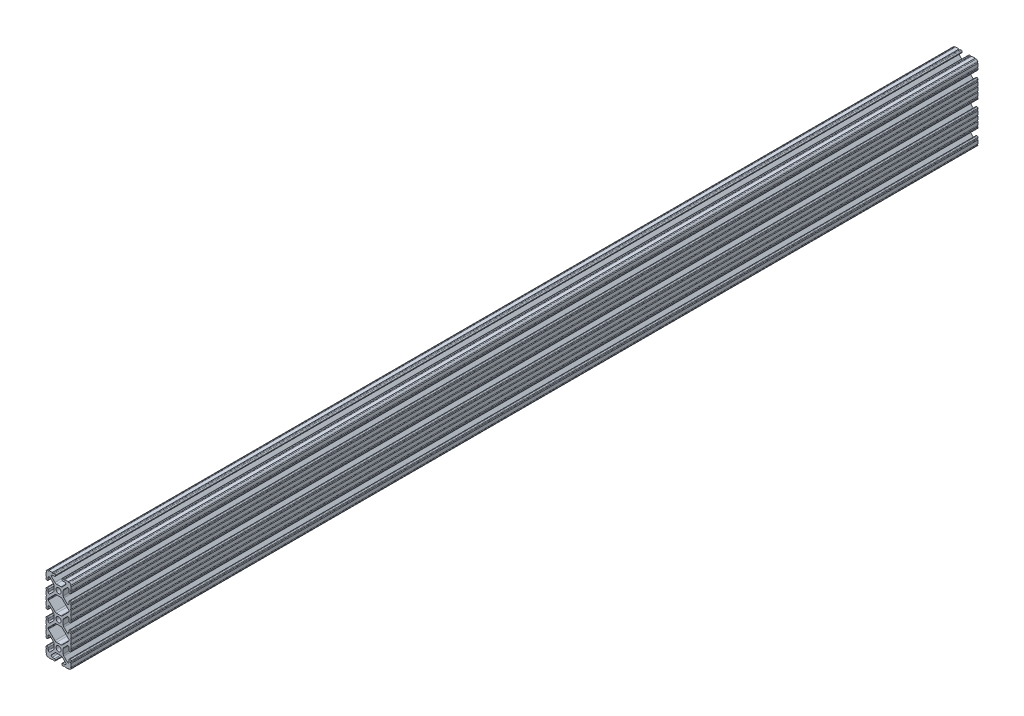
from build123d import *

# Parameters (mm, degrees)
BOSS_EXTRUDE1_DEPTH     = 457.2
CUT_EXTRUDE1_DEPTH      = 459.96049939
CUT_EXTRUDE1_DEPTH_BACK = 459.96049939
SKETCH5_R               = 0.55245
BOSS_EXTRUDE2_DEPTH     = 457.2
CUT_EXTRUDE2_DEPTH      = 459.96049939
CUT_EXTRUDE2_DEPTH_BACK = 459.96049939


with BuildPart() as part:
    # Sketch4 → Boss-Extrude1 (new, symmetric)
    with BuildSketch(Plane.XY):
        with BuildLine():
            Line((4.190365, -38.1), (10.11729625, -38.1))
            ThreePointArc((10.11729625, -38.1), (11.943543585, -37.343543585), (12.7, -35.51729625))
            Line((12.7, -35.51729625), (12.7, -29.590365))
            ThreePointArc((12.7, -29.590365), (12.42492494, -28.92627506), (11.760835, -28.6512))
            Line((11.760835, -28.6512), (11.429365, -28.6512))
            ThreePointArc((11.429365, -28.6512), (10.76527506, -28.92627506), (10.4902, -29.590365))
            Line((10.4902, -29.590365), (10.4902, -31.748478019))
            ThreePointArc((10.4902, -31.748478019), (9.830707141, -32.735478831), (8.666460301, -32.503895736))
            Line((8.666460301, -32.503895736), (5.299899128, -29.137334563))
            ThreePointArc((5.299899128, -29.137334563), (4.817571085, -28.415479634), (4.6482, -27.56399369))
            Line((4.6482, -27.56399369), (4.6482, -25.4))
            Line((4.6482, -25.4), (2.6035, -25.4))
            ThreePointArc((2.6035, -25.4), (1.840952505, -27.240952505), (0, -28.0035))
            Line((0, -28.0035), (0, -30.0482))
            Line((0, -30.0482), (2.16399369, -30.0482))
            ThreePointArc((2.16399369, -30.0482), (3.015479634, -30.217571085), (3.737334563, -30.699899128))
            Line((3.737334563, -30.699899128), (7.103895736, -34.066460301))
            ThreePointArc((7.103895736, -34.066460301), (7.335478831, -35.230707141), (6.348478019, -35.8902))
            Line((6.348478019, -35.8902), (4.190365, -35.8902))
            ThreePointArc((4.190365, -35.8902), (3.52627506, -36.16527506), (3.2512, -36.829365))
            Line((3.2512, -36.829365), (3.2512, -37.160835))
            ThreePointArc((3.2512, -37.160835), (3.52627506, -37.82492494), (4.190365, -38.1))
        make_face()
    extrude(amount=BOSS_EXTRUDE1_DEPTH, both=True)

    # Sketch5 → Cut-Extrude1 (cut, two sides: drawn at the far end of the back side and taken through both)
    with BuildSketch(Plane.XY.offset(-CUT_EXTRUDE1_DEPTH_BACK)):
        with Locations((10.356153152, -38.1)):
            Circle(SKETCH5_R)
        with Locations((5.796028019, -38.1)):
            Circle(SKETCH5_R)
        with Locations((12.7, -35.756153152)):
            Circle(SKETCH5_R)
        with Locations((12.7, -31.196028019)):
            Circle(SKETCH5_R)
    extrude(amount=CUT_EXTRUDE1_DEPTH + CUT_EXTRUDE1_DEPTH_BACK, mode=Mode.SUBTRACT)

    # Mirror1: part across plane


with BuildPart() as part_1:
    add(part.part)
    add(part.part.mirror(Plane(origin=(4.6482, -25.4, 457.2), x_dir=(0, 0, 1), z_dir=(0, -1, 0))))

    # Sketch6 → Boss-Extrude2 (add, symmetric)
    with BuildSketch(Plane.XY):
        with BuildLine():
            Line((12.7, -14.491396848), (12.7, -12.7))
            Line((12.7, -12.7), (9.803703152, -12.7))
            Line((9.803703152, -12.7), (9.803703152, -15.596296848))
            Line((9.803703152, -15.596296848), (12.7, -15.596296848))
            ThreePointArc((12.7, -15.596296848), (12.14755, -15.043846848), (12.7, -14.491396848))
        make_face()
    extrude(amount=BOSS_EXTRUDE2_DEPTH, both=True)

    # Sketch7 → Cut-Extrude2 (cut, two sides: drawn at the far end of the back side and taken through both)
    with BuildSketch(Plane.XY.offset(-CUT_EXTRUDE2_DEPTH_BACK)):
        with BuildLine():
            Line((5.420615149, -18.416820286), (10.328391141, -13.509044294))
            ThreePointArc((10.328391141, -13.509044294), (10.448147248, -13.329816615), (10.4902, -13.118403152))
            Line((10.4902, -13.118403152), (10.4902, -12.7))
            Line((10.4902, -12.7), (0, -12.7))
            Line((0, -12.7), (5.420615149, -18.416820286))
        make_face()
    extrude(amount=CUT_EXTRUDE2_DEPTH + CUT_EXTRUDE2_DEPTH_BACK, mode=Mode.SUBTRACT)

    # Mirror2: part across plane


with BuildPart() as part_2:
    add(part_1.part)
    add(part_1.part.mirror(Plane(origin=(4.190365, -12.7, 457.2), x_dir=(0, 0, 1), z_dir=(0, -1, 0))))

    # SurfaceCut1
    split(bisect_by=Plane(origin=(0, 0, 0), x_dir=(1, 0, 0), z_dir=(0, 1, 0)), keep=Keep.BOTTOM)

    # Mirror3: part across plane


with BuildPart() as part_3:
    add(part_2.part)
    add(part_2.part.mirror(Plane(origin=(0, 0, 0), x_dir=(0, 0, 1), z_dir=(1, 0, 0))))

    # Mirror4: part across plane


with BuildPart() as part_4:
    add(part_3.part)
    add(part_3.part.mirror(Plane.ZX))


solid = part_4.part
